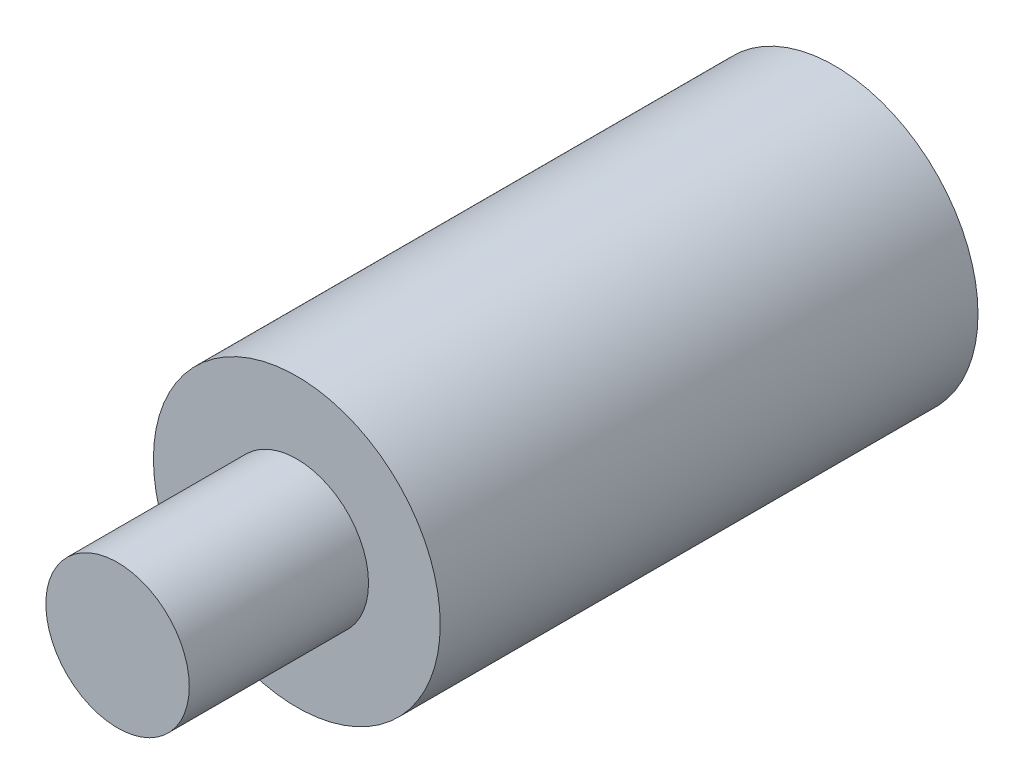
from build123d import *

# Parameters (mm, degrees)
SKETCH1_R           = 4
BOSS_EXTRUDE1_DEPTH = 15
SKETCH2_R           = 2
BOSS_EXTRUDE2_DEPTH = 5
SKETCH3_R           = 1.5
CUT_EXTRUDE1_DEPTH  = 10


with BuildPart() as part:
    # Sketch1 → Boss-Extrude1 (new body)
    with BuildSketch(Plane.XY):
        Circle(SKETCH1_R)
    extrude(amount=BOSS_EXTRUDE1_DEPTH)

    # Sketch2 → Boss-Extrude2 (add)
    with BuildSketch(Plane.XY.offset(15)):
        Circle(SKETCH2_R)
    extrude(amount=BOSS_EXTRUDE2_DEPTH)

    # Sketch3 → Cut-Extrude1 (cut)
    with BuildSketch(Plane(origin=(0, 0, 0), x_dir=(-1, 0, 0), z_dir=(0, 0, -1))):
        Circle(SKETCH3_R)
    extrude(amount=-CUT_EXTRUDE1_DEPTH, mode=Mode.SUBTRACT)


solid = part.part
